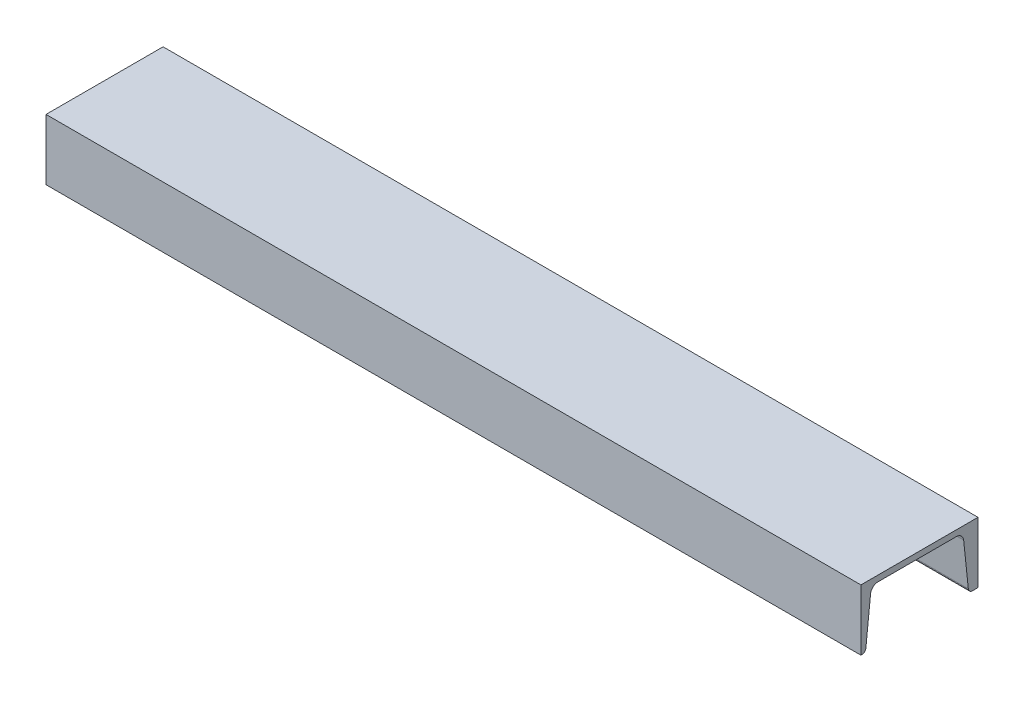
from build123d import *

# Parameters (mm, degrees)
C_CHANNEL_120_X_12_1_DEPTH = 870


with BuildPart() as part:
    # Sketch12 → C channel 120 X 12(1) (new body)
    with BuildSketch(Plane(origin=(0, 0, 0), x_dir=(0, -1, 0), z_dir=(-1, 0, 0))):
        with BuildLine():
            Line((65, 125), (0, 125))
            Line((0, 125), (0, 0))
            Line((0, 0), (65, 0))
            Line((65, 0), (65, 5.845330836))
            ThreePointArc((65, 5.845330836), (63.844151715, 8.856418565), (60.970378085, 10.320679365))
            Line((60.970378085, 10.320679365), (13.463772294, 15.313824837))
            ThreePointArc((13.463772294, 15.313824837), (8.354841396, 17.916955149), (6.3, 23.27))
            Line((6.3, 23.27), (6.3, 106.74))
            ThreePointArc((6.3, 106.74), (8.354841396, 112.093044851), (13.463772294, 114.696175163))
            Line((13.463772294, 114.696175163), (60.970378085, 119.689320635))
            ThreePointArc((60.970378085, 119.689320635), (63.844151715, 121.153581435), (65, 124.164669164))
            Line((65, 124.164669164), (65, 125))
        make_face()
    extrude(amount=C_CHANNEL_120_X_12_1_DEPTH)


solid = part.part
